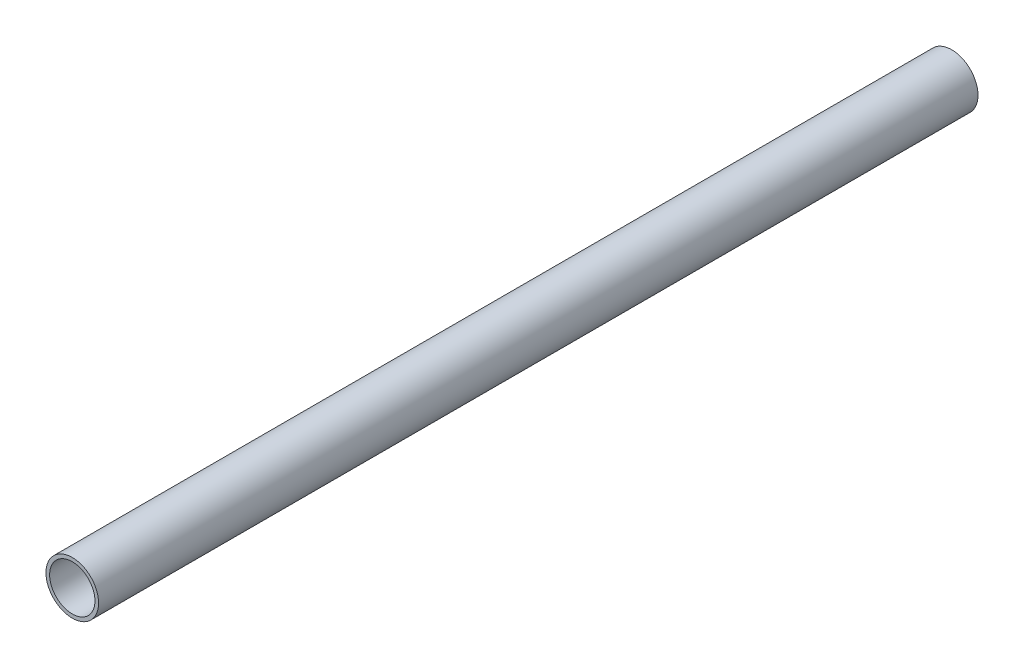
from build123d import *

# Parameters (mm, degrees)
SKETCH_1_R      = 7.55
SKETCH_1_R_2    = 6.5
EXTRUDE_1_DEPTH = 252.3


with BuildPart() as part:
    # 草图1 → 凸台-拉伸1 (new body)
    with BuildSketch(Plane.XY):
        Circle(SKETCH_1_R)
        Circle(SKETCH_1_R_2, mode=Mode.SUBTRACT)
    extrude(amount=EXTRUDE_1_DEPTH)


solid = part.part
